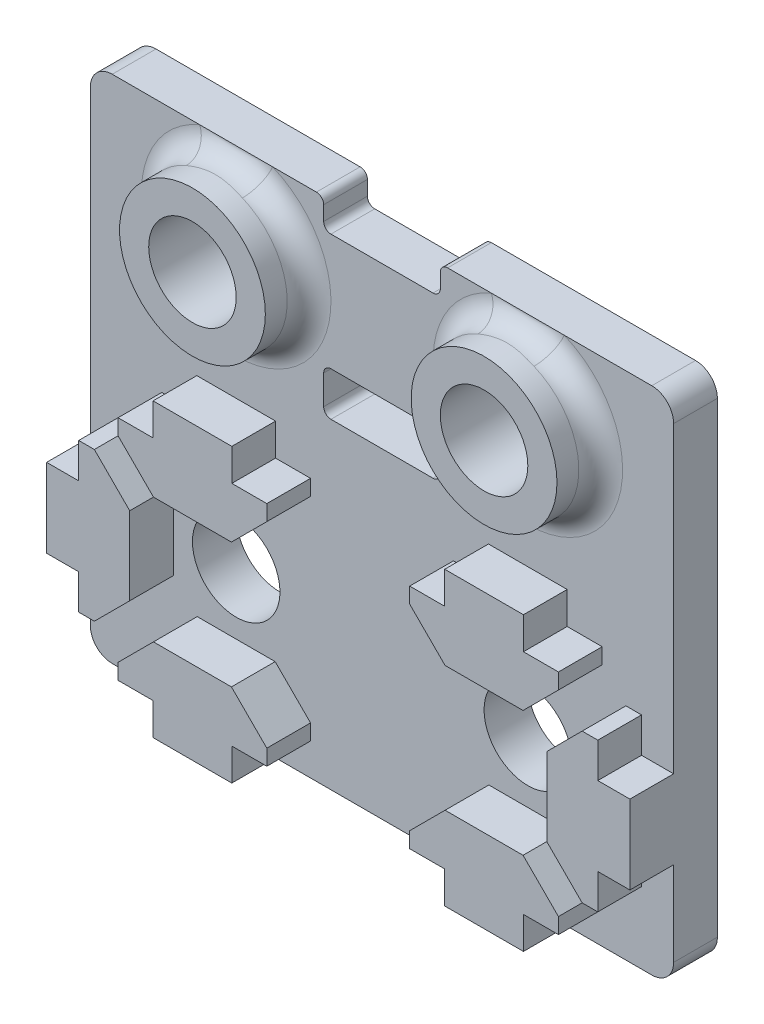
from build123d import *

# Parameters (mm, degrees)
SKETCH_1_W          = 40
SKETCH_1_H          = 20
EXTRUDE_1_DEPTH     = 3
EXTRUDE_2_DEPTH     = 3
SKETCH_3_R          = 3
CUT_EXTRUDE_1_DEPTH = 3
SKETCH_4_W          = 40
SKETCH_4_H          = 15
SKETCH_4_R          = 3
EXTRUDE_3_DEPTH     = 3
FILLET_3_R          = 1.5
SKETCH_5_R          = 5
SKETCH_5_R_2        = 3
EXTRUDE_4_DEPTH     = 3
FILLET_4_R          = 1.5
CUT_EXTRUDE_2_DEPTH = 10
FILLET_6_R          = 0.5
CUT_EXTRUDE_3_DEPTH = 3


with BuildPart() as part:
    # 草图1 → 凸台-拉伸1 (new body)
    with BuildSketch(Plane.XY):
        Rectangle(SKETCH_1_W, SKETCH_1_H)
    extrude(amount=EXTRUDE_1_DEPTH)

    # 草图2 → 凸台-拉伸2 (add)
    with BuildSketch(Plane.XY.offset(3)):
        Polygon((-6.9, 8.2), (-6.9, 10), (-13.1, 10), (-13.1, 8.2), (-15.5, 8.2), (-15.5, 6.560660172), (-12.839339828, 3.9), (-7.160660172, 3.9), (-4.5, 6.560660172), (-4.5, 8.2), align=None)
        Polygon((-16.560660172, 5.5), (-18.2, 5.5), (-18.2, 3.1), (-20, 3.1), (-20, -3.1), (-18.2, -3.1), (-18.2, -5.5), (-16.560660172, -5.5), (-13.9, -2.839339828), (-13.9, 2.839339828), align=None)
        Polygon((-12.839339828, -3.9), (-7.160660172, -3.9), (-4.5, -6.560660172), (-4.5, -8.2), (-6.9, -8.2), (-6.9, -10), (-13.1, -10), (-13.1, -8.2), (-15.5, -8.2), (-15.5, -6.560660172), align=None)
        Polygon((18.2, 3.1), (20, 3.1), (20, -3.1), (18.2, -3.1), (18.2, -5.5), (16.560660172, -5.5), (13.9, -2.839339828), (13.9, 2.839339828), (16.560660172, 5.5), (18.2, 5.5), align=None)
        Polygon((13.1, 8.2), (13.1, 10), (6.9, 10), (6.9, 8.2), (4.5, 8.2), (4.5, 6.560660172), (7.160660172, 3.9), (12.839339828, 3.9), (15.5, 6.560660172), (15.5, 8.2), align=None)
        Polygon((7.160660172, -3.9), (12.839339828, -3.9), (15.5, -6.560660172), (15.5, -8.2), (13.1, -8.2), (13.1, -10), (6.9, -10), (6.9, -8.2), (4.5, -8.2), (4.5, -6.560660172), align=None)
    extrude(amount=EXTRUDE_2_DEPTH)

    # 草图3 → 切除-拉伸1 (cut)
    with BuildSketch(Plane(origin=(0, 0, 0), x_dir=(-1, 0, 0), z_dir=(0, 0, -1))):
        with Locations((-10, 0)):
            Circle(SKETCH_3_R)
        with Locations((10, 0)):
            Circle(SKETCH_3_R)
    extrude(amount=-CUT_EXTRUDE_1_DEPTH, mode=Mode.SUBTRACT)

    # 草图4 → 凸台-拉伸3 (add)
    with BuildSketch(Plane(origin=(0, 0, 0), x_dir=(-1, 0, 0), z_dir=(0, 0, -1))):
        with Locations((0, 17.5)):
            Rectangle(SKETCH_4_W, SKETCH_4_H)
        with Locations((-10, 19)):
            Circle(SKETCH_4_R, mode=Mode.SUBTRACT)
        with Locations((10, 19)):
            Circle(SKETCH_4_R, mode=Mode.SUBTRACT)
    extrude(amount=-EXTRUDE_3_DEPTH)

    # 圆角3
    fillet_3_edges = [part.edges().sort_by_distance(p)[0] for p in [
        (20, 25, 1.5),
        (-20, 25, 1.5),
        (20, -10, 1.5),
        (-20, -10, 1.5),
    ]]
    fillet(fillet_3_edges, radius=FILLET_3_R)

    # 草图5 → 凸台-拉伸4 (add)
    # profile 1 of 2: a face of its own
    with BuildSketch(Plane.XY.offset(3)):
        with Locations(Location((-10, 19, 0), (0, 0, 180))):
            Circle(SKETCH_5_R)
        with Locations(Location((-10, 19, 0), (0, 0, 180))):
            Circle(SKETCH_5_R_2, mode=Mode.SUBTRACT)
    # profile 2 of 2: a face of its own
    with BuildSketch(Plane.XY.offset(3)):
        with Locations(Location((10, 19, 0), (0, 0, 180))):
            Circle(SKETCH_5_R)
        with Locations(Location((10, 19, 0), (0, 0, 180))):
            Circle(SKETCH_5_R_2, mode=Mode.SUBTRACT)
    extrude(amount=EXTRUDE_4_DEPTH)

    # 圆角4
    fillet_4_edges = [part.edges().sort_by_distance(p)[0] for p in [
        (-5, 19, 3),
        (15, 19, 3),
    ]]
    fillet(fillet_4_edges, radius=FILLET_4_R)

    # 草图6 → 切除-拉伸2 (cut)
    with BuildSketch(Plane(origin=(0, 0, 0), x_dir=(-1, 0, 0), z_dir=(0, 0, -1))):
        Polygon((0, 23.005790595), (4, 23.005790595), (4, 25), (-4, 25), (-4, 23.005790595), align=None)
        Polygon((0, 15.005790595), (-4, 15.005790595), (-4, 12.005790595), (4, 12.005790595), (4, 15.005790595), align=None)
    extrude(amount=-CUT_EXTRUDE_2_DEPTH, mode=Mode.SUBTRACT)

    # 圆角6
    fillet_6_edges = [part.edges().sort_by_distance(p)[0] for p in [
        (4, 25, 1.5),
        (-4, 25, 1.5),
        (-4, 23.005790595, 1.5),
        (4, 23.005790595, 1.5),
        (4, 12.005790595, 1.5),
        (4, 15.005790595, 1.5),
        (-4, 15.005790595, 1.5),
        (-4, 12.005790595, 1.5),
    ]]
    fillet(fillet_6_edges, radius=FILLET_6_R)

    # 草图7 → 切除-拉伸3 (cut)
    with BuildSketch(Plane.XY.offset(6)):
        Polygon((-18.2, -3.1), (-18.2, -5.5), (-16.560660172, -5.5), (-13.9, -2.839339828), (-13.9, 2.839339828), (-16.560660172, 5.5), (-18.2, 5.5), (-18.2, 3.1), (-20, 3.1), (-20, 2.7), (-19.6, 2.7), (-17.8, 2.7), (-17.8, 5.1), (-16.726345597, 5.1), (-14.3, 2.673654403), (-14.3, -2.673654403), (-16.726345597, -5.1), (-17.8, -5.1), (-17.8, -2.7), (-19.6, -2.7), (-20, -2.7), (-20, -3.1), align=None)
        Polygon((-12.839339828, -3.9), (-15.5, -6.560660172), (-15.5, -8.2), (-13.1, -8.2), (-13.1, -10), (-12.7, -10), (-12.7, -9.6), (-12.7, -7.8), (-15.1, -7.8), (-15.1, -6.726345597), (-12.673654403, -4.3), (-7.326345597, -4.3), (-4.9, -6.726345597), (-4.9, -7.8), (-7.3, -7.8), (-7.3, -9.6), (-7.3, -10), (-6.9, -10), (-6.9, -8.2), (-4.5, -8.2), (-4.5, -6.560660172), (-7.160660172, -3.9), align=None)
        Polygon((-4.5, 8.2), (-6.9, 8.2), (-6.9, 10), (-7.3, 10), (-7.3, 9.6), (-7.3, 7.8), (-4.9, 7.8), (-4.9, 6.726345597), (-7.326345597, 4.3), (-12.673654403, 4.3), (-15.1, 6.726345597), (-15.1, 7.8), (-12.7, 7.8), (-12.7, 9.6), (-12.7, 10), (-13.1, 10), (-13.1, 8.2), (-15.5, 8.2), (-15.5, 6.560660172), (-12.839339828, 3.9), (-7.160660172, 3.9), (-4.5, 6.560660172), align=None)
        Polygon((15.5, 8.2), (13.1, 8.2), (13.1, 10), (12.7, 10), (12.7, 9.6), (12.7, 7.8), (15.1, 7.8), (15.1, 6.726345597), (12.673654403, 4.3), (7.326345597, 4.3), (4.9, 6.726345597), (4.9, 7.8), (7.3, 7.8), (7.3, 9.6), (7.3, 10), (6.9, 10), (6.9, 8.2), (4.5, 8.2), (4.5, 6.560660172), (7.160660172, 3.9), (12.839339828, 3.9), (15.5, 6.560660172), align=None)
        Polygon((18.2, 3.1), (18.2, 5.5), (16.560660172, 5.5), (13.9, 2.839339828), (13.9, -2.839339828), (16.560660172, -5.5), (18.2, -5.5), (18.2, -3.1), (20, -3.1), (20, -2.7), (19.6, -2.7), (17.8, -2.7), (17.8, -5.1), (16.726345597, -5.1), (14.3, -2.673654403), (14.3, 2.673654403), (16.726345597, 5.1), (17.8, 5.1), (17.8, 2.7), (19.6, 2.7), (20, 2.7), (20, 3.1), align=None)
        Polygon((7.160660172, -3.9), (4.5, -6.560660172), (4.5, -8.2), (6.9, -8.2), (6.9, -10), (7.3, -10), (7.3, -9.6), (7.3, -7.8), (4.9, -7.8), (4.9, -6.726345597), (7.326345597, -4.3), (12.673654403, -4.3), (15.1, -6.726345597), (15.1, -7.8), (12.7, -7.8), (12.7, -9.6), (12.7, -10), (13.1, -10), (13.1, -8.2), (15.5, -8.2), (15.5, -6.560660172), (12.839339828, -3.9), align=None)
    extrude(amount=-CUT_EXTRUDE_3_DEPTH, mode=Mode.SUBTRACT)


solid = part.part
